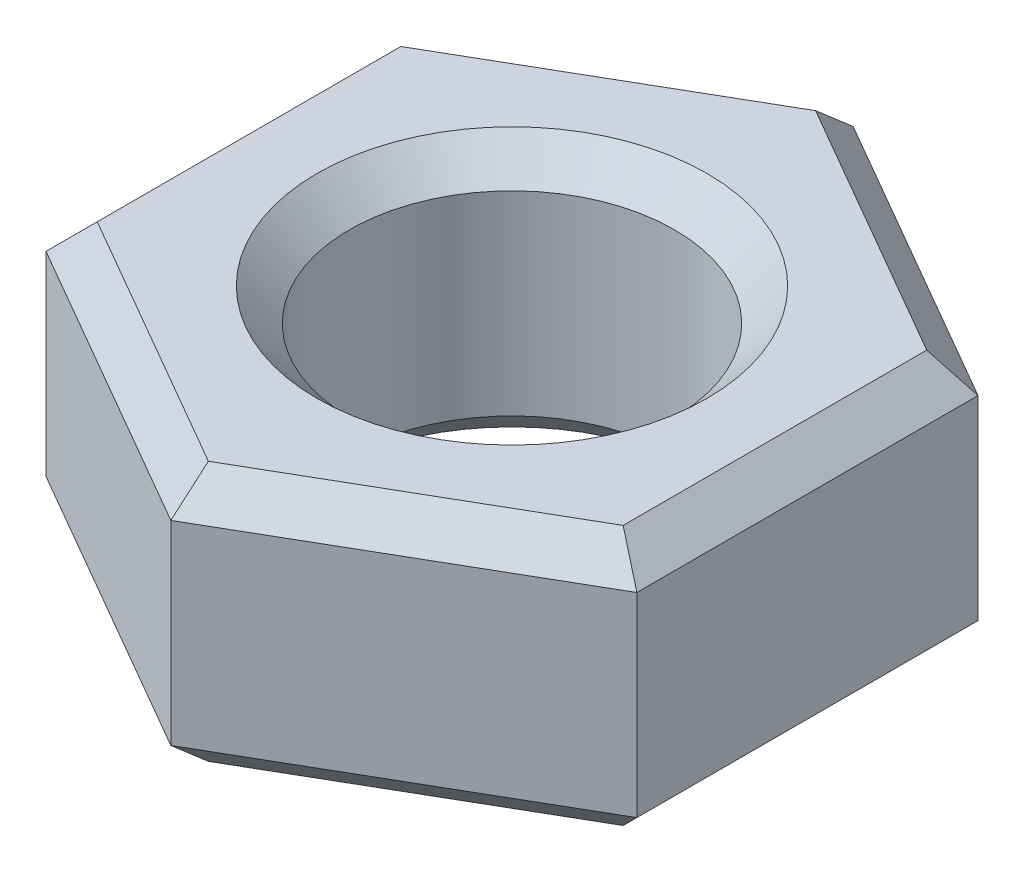
from build123d import *

# Parameters (mm, degrees)
ESQUISSE1_R        = 1.5
BOSS_EXTRU_1_DEPTH = 2.4
CHANFREIN1_SIZE    = 0.3


with BuildPart() as part:
    # Esquisse1 → Boss.-Extru.1 (new body)
    with BuildSketch(Plane(origin=(0, 0, 0), x_dir=(1, 0, 0), z_dir=(0, 1, 0))):
        Polygon((0, 3.15), (-2.727980022, 1.575), (-2.727980022, -1.575), (0, -3.15), (2.727980022, -1.575), (2.727980022, 1.575), align=None)
        with Locations(Location((0, 0, 0), (0, 0, 270))):
            Circle(ESQUISSE1_R, mode=Mode.SUBTRACT)
    extrude(amount=BOSS_EXTRU_1_DEPTH)

    # Chanfrein1
    chanfrein1_edges = [part.edges().sort_by_distance(p)[0] for p in [
        (-2.727980022, 2.4, 0),
        (-1.363990011, 2.4, 2.3625),
        (0, 0, -1.5),
        (0, 2.4, -1.5),
        (1.363990011, 2.4, 2.3625),
        (2.727980022, 2.4, 0),
        (1.363990011, 2.4, -2.3625),
        (2.727980022, 0, 0),
        (1.363990011, 0, 2.3625),
        (-1.363990011, 0, 2.3625),
        (-2.727980022, 0, 0),
        (-1.363990011, 0, -2.3625),
        (1.363990011, 0, -2.3625),
        (-1.363990011, 2.4, -2.3625),
    ]]
    chamfer(chanfrein1_edges, length=CHANFREIN1_SIZE)


solid = part.part
